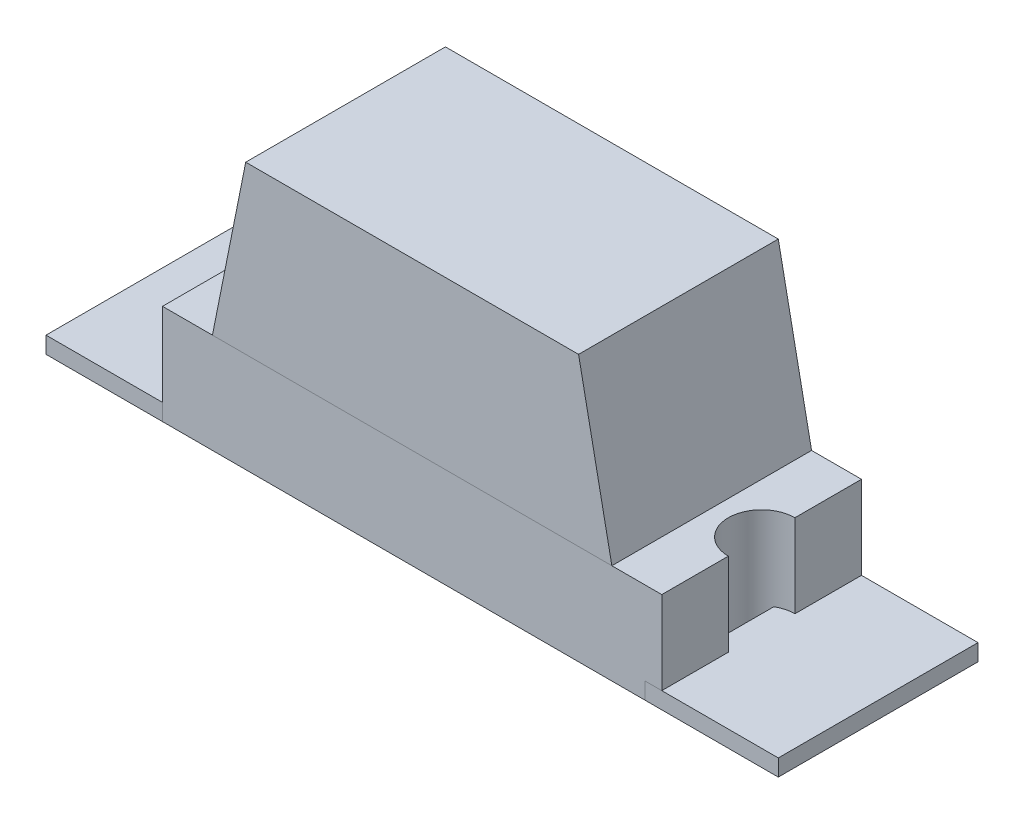
from build123d import *

# Parameters (mm, degrees)
BOSS_EXTRUDE1_DEPTH   = 0.3
SKETCH3_W             = 0.25
SKETCH3_H             = 0.2
SKETCH4_W             = 0.4
SKETCH4_H             = 0.6
BOSS_EXTRUDE4_DEPTH   = 0.05
BOSS_EXTRUDE4_2_DEPTH = 0.05
BOSS_EXTRUDE5_DEPTH   = 0.3


with BuildPart() as part:
    # Sketch1 → Boss-Extrude1 (new body)
    with BuildSketch(Plane(origin=(0, 0, 0), x_dir=(1, 0, 0), z_dir=(0, 1, 0))):
        with BuildLine():
            Line((-0.75, 0.3), (0.75, 0.3))
            Line((0.75, 0.3), (0.75, 0.1))
            ThreePointArc((0.75, 0.1), (0.65, 0), (0.75, -0.1))
            Line((0.75, -0.1), (0.75, -0.3))
            Line((0.75, -0.3), (-0.75, -0.3))
            Line((-0.75, -0.3), (-0.75, -0.1))
            ThreePointArc((-0.75, -0.1), (-0.65, 0), (-0.75, 0.1))
            Line((-0.75, 0.1), (-0.75, 0.3))
        make_face()
    extrude(amount=BOSS_EXTRUDE1_DEPTH)


with BuildPart() as body_2:
    # Sketch3 → Revolve1 (revolve)
    with BuildSketch(Plane.XY, mode=Mode.PRIVATE) as revolve1_sk:
        with Locations((0.125, 0.4)):
            Rectangle(SKETCH3_W, SKETCH3_H)
    revolve(revolve1_sk.sketch.rotate(Axis((0, 0.809216282, 0), (0, -1, 0)), 90), axis=Axis((0, 0.809216282, 0), (0, -1, 0)))


with BuildPart() as body_3:
    # Sketch4 → Boss-Extrude4 (new body)
    with BuildSketch(Plane(origin=(0, 0, 0), x_dir=(1, 0, 0), z_dir=(0, 1, 0))):
        with Locations((0.9, 0)):
            Rectangle(SKETCH4_W, SKETCH4_H)
    extrude(amount=BOSS_EXTRUDE4_DEPTH)


with BuildPart() as body_4:
    # Sketch4 → Boss-Extrude4 2 (new body)
    with BuildSketch(Plane(origin=(0, 0, 0), x_dir=(1, 0, 0), z_dir=(0, 1, 0))):
        with Locations((-0.9, 0)):
            Rectangle(SKETCH4_W, SKETCH4_H)
    extrude(amount=BOSS_EXTRUDE4_2_DEPTH)


with BuildPart() as body_5:
    # Sketch2 → Boss-Extrude5 (new, symmetric)
    with BuildSketch(Plane.XY):
        Polygon((-0.6, 0.3), (0.6, 0.3), (0.5, 0.8), (-0.5, 0.8), align=None)
    extrude(amount=BOSS_EXTRUDE5_DEPTH, both=True)


solid = Compound([part.part, body_2.part, body_3.part, body_4.part, body_5.part])
